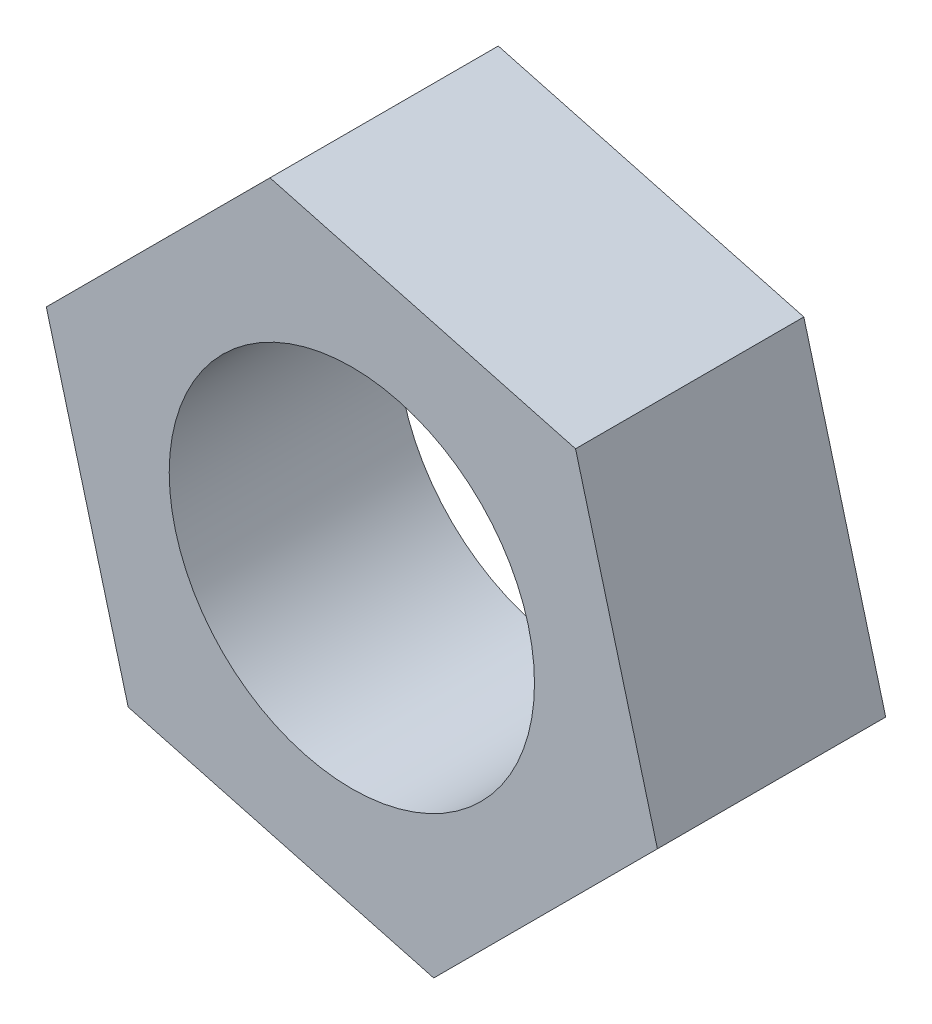
from build123d import *

# Parameters (mm, degrees)
CROQUIS1_R              = 6
CROQUIS1_R_2            = 2.5
SALIENTE_EXTRUIR1_DEPTH = 5
CROQUIS2_R              = 4
SALIENTE_EXTRUIR2_DEPTH = 5
CROQUIS3_R              = 4
CORTAR_EXTRUIR1_DEPTH   = 10


with BuildPart() as part:
    # Croquis1 → Saliente-Extruir1 (new body)
    with BuildSketch(Plane.XY):
        Circle(CROQUIS1_R)
        Circle(CROQUIS1_R_2, mode=Mode.SUBTRACT)
    extrude(amount=SALIENTE_EXTRUIR1_DEPTH)

    # Croquis2 → Saliente-Extruir2 (add)
    with BuildSketch(Plane.XY.offset(5)):
        Polygon((-6.692111353, 1.79322214), (-1.793079748, 6.692149506), (4.899031604, 4.898927366), (6.692111353, -1.79322214), (1.793079748, -6.692149506), (-4.899031604, -4.898927366), align=None)
        Circle(CROQUIS2_R, mode=Mode.SUBTRACT)
    extrude(amount=-SALIENTE_EXTRUIR2_DEPTH)

    # Croquis3 → Cortar-Extruir1 (cut)
    with BuildSketch(Plane(origin=(0, 0, 0), x_dir=(-1, 0, 0), z_dir=(0, 0, -1))):
        Circle(CROQUIS3_R)
    extrude(amount=-CORTAR_EXTRUIR1_DEPTH, mode=Mode.SUBTRACT)


solid = part.part
